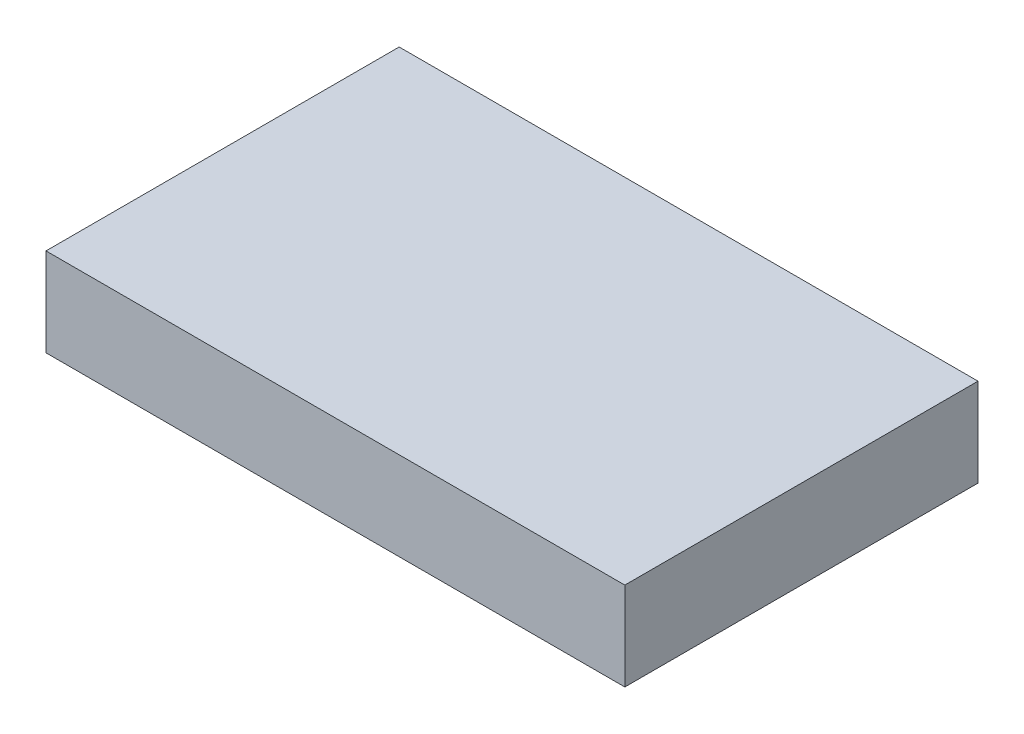
from build123d import *

# Parameters (mm, degrees)
SKETCH1_W           = 59
SKETCH1_H           = 36
BOSS_EXTRUDE1_DEPTH = 9


with BuildPart() as part:
    # Sketch1 → Boss-Extrude1 (new body)
    with BuildSketch(Plane(origin=(0, 0, 0), x_dir=(1, 0, 0), z_dir=(0, 1, 0))):
        Rectangle(SKETCH1_W, SKETCH1_H)
    extrude(amount=BOSS_EXTRUDE1_DEPTH)


solid = part.part
